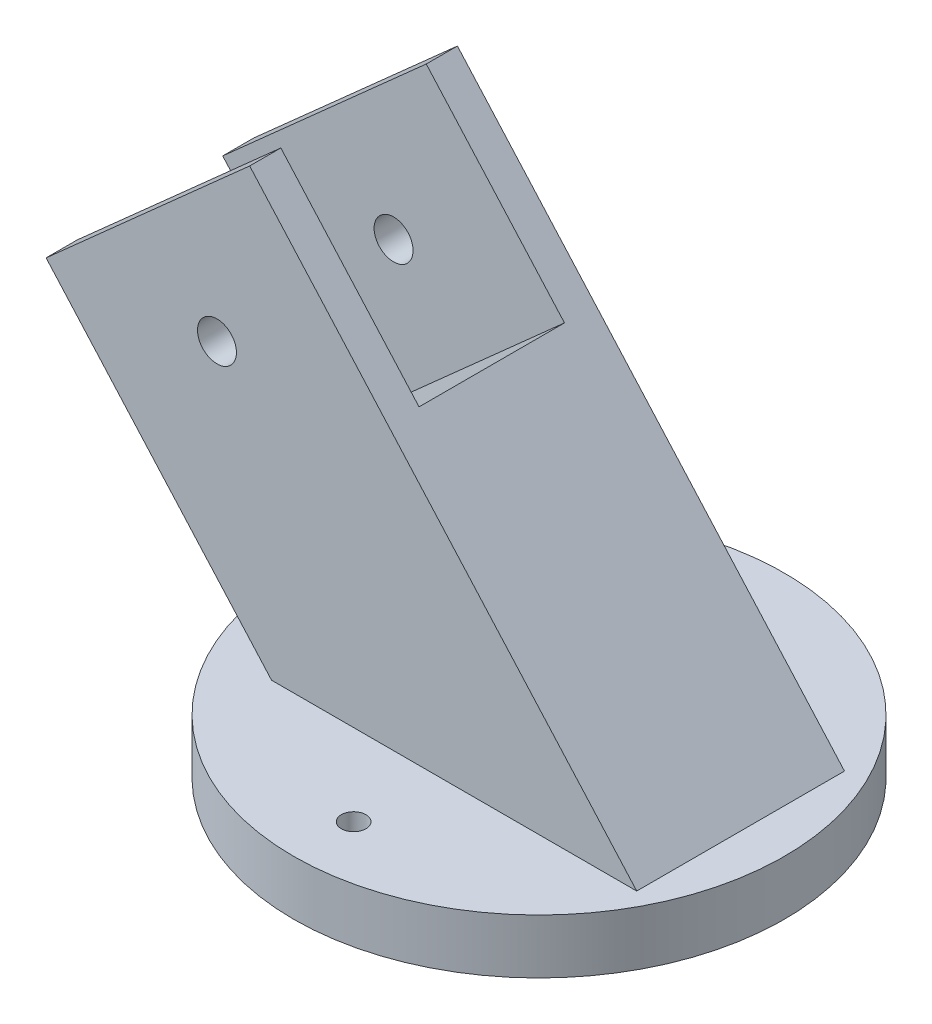
from build123d import *

# Parameters (mm, degrees)
SKETCH1_R                = 45
SKETCH1_R_2              = 2.25
BOSS_EXTRUDE1_DEPTH      = 10
BOSS_EXTRUDE2_DEPTH      = 19.05
BOSS_EXTRUDE2_DEPTH_BACK = 19.05
SKETCH3_W                = 50
SKETCH3_H                = 26.67
CUT_EXTRUDE1_DEPTH       = 38.1
F_1_4_CLEARANCE_HOLE1_D  = 7.14248


with BuildPart() as part:
    # Sketch1 → Boss-Extrude1 (new body)
    with BuildSketch(Plane(origin=(0, 0, 0), x_dir=(1, 0, 0), z_dir=(0, 1, 0))):
        Circle(SKETCH1_R)
        with Locations((0, 34)):
            Circle(SKETCH1_R_2, mode=Mode.SUBTRACT)
        with Locations((0, -34)):
            Circle(SKETCH1_R_2, mode=Mode.SUBTRACT)
    extrude(amount=BOSS_EXTRUDE1_DEPTH)

    # Sketch2 → Boss-Extrude2 (add, two sides: drawn at the far end of the back side and taken through both)
    with BuildSketch(Plane.XY.offset(-BOSS_EXTRUDE2_DEPTH_BACK)):
        Polygon((36.966840414, 10), (-34.013367398, 89.666438803), (-71.345276512, 56.40492107), (-30, 10), align=None)
    extrude(amount=BOSS_EXTRUDE2_DEPTH + BOSS_EXTRUDE2_DEPTH_BACK)

    # Sketch3 → Cut-Extrude1 (cut)
    with BuildSketch(Plane(origin=(-59.588083083, 66.880198307, 0), x_dir=(0.7466381822853925, 0.6652303546543595, 0), z_dir=(-0.6652303546543595, 0.7466381822853925, 0))):
        with Locations((9.253158078, 0)):
            Rectangle(SKETCH3_W, SKETCH3_H)
    extrude(amount=-CUT_EXTRUDE1_DEPTH, mode=Mode.SUBTRACT)

    # 1/4 Clearance Hole1 (through all)
    with Locations(Plane.XY.offset(19.05)):
        with Locations((-40.006683699, 58.812222564)):
            Hole(F_1_4_CLEARANCE_HOLE1_D / 2)


solid = part.part
